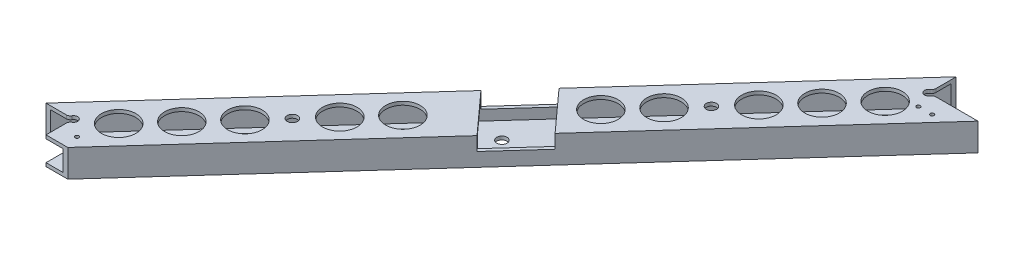
from build123d import *

# Parameters (mm, degrees)
BOSS_EXTRUDE1_DEPTH          = 25.4
CUT_EXTRUDE1_DEPTH           = 12.7
SKETCH3_W                    = 44.450000002
SKETCH3_H                    = 19.05
CUT_EXTRUDE2_DEPTH           = 645.494549375
F_3_8_0_375_DIAMETER_HOLE1_D = 9.525
CUT_EXTRUDE3_DEPTH           = 637.52463446
F_8_32_TAPPED_HOLE1_D        = 3.4544
SKETCH9_R                    = 3.81
CUT_EXTRUDE4_DEPTH           = 637.52463446
FILLET1_R                    = 3.81
F_8_32_TAPPED_HOLE2_D        = 3.4544
SKETCH12_R                   = 15.875000001
CUT_EXTRUDE5_DEPTH           = 637.52463446


with BuildPart() as part:
    # Sketch1 → Boss-Extrude1 (new body)
    with BuildSketch(Plane(origin=(0, 0, 0), x_dir=(1, 0, 0), z_dir=(0, 1, 0))):
        Polygon((386.547411153, 441.325), (432.072013268, 441.325), (12.7, -22.245579509), (12.7, 25.4), (-12.7, 25.4), (386.547411153, 466.725), align=None)
    extrude(amount=BOSS_EXTRUDE1_DEPTH)

    # Sketch2 → Cut-Extrude1 (cut)
    with BuildSketch(Plane(origin=(0, 25.4, 0), x_dir=(1, 0, 0), z_dir=(0, 1, 0))):
        Polygon((212.323705576, 274.139463524), (246.575140768, 236.278192008), (212.323705576, 198.416920491), (178.072270385, 236.278192008), align=None)
    extrude(amount=-CUT_EXTRUDE1_DEPTH, mode=Mode.SUBTRACT)

    # Sketch3 → Cut-Extrude2 (cut, through all)
    with BuildSketch(Plane(origin=(-5.351336248, 0, 5.915325694), x_dir=(-0.7415747649396567, 0, -0.6708702318665609), z_dir=(0.6708702318665609, 0, -0.7415747649396567))):
        with Locations((1.058103403, 12.7)):
            Rectangle(SKETCH3_W, SKETCH3_H)
    extrude(amount=CUT_EXTRUDE2_DEPTH, mode=Mode.SUBTRACT)

    # 3/8 (0.375) Diameter Hole1 (through all)
    with Locations(Plane(origin=(0, 25.4, 0), x_dir=(1, 0, 0), z_dir=(0, 1, 0))):
        with Locations((113.347215967, 126.870346004), (297.173362109, 330.070346004), (205.260289038, 228.470346004)):
            Hole(F_3_8_0_375_DIAMETER_HOLE1_D / 2)

    # Sketch6 → Cut-Extrude3 (cut, through all)
    with BuildSketch(Plane(origin=(0, 25.4, 0), x_dir=(1, 0, 0), z_dir=(0, 1, 0))):
        Polygon((12.7, -22.245579509), (32.824602115, 0), (12.7, 0), align=None)
    extrude(amount=-CUT_EXTRUDE3_DEPTH, mode=Mode.SUBTRACT)

    # #8-32 Tapped Hole1 (through all)
    with Locations(Plane(origin=(0, 25.4, 0), x_dir=(1, 0, 0), z_dir=(0, 1, 0))):
        with Locations((28.575, 12.7)):
            Hole(F_8_32_TAPPED_HOLE1_D / 2)

    # Sketch9 → Cut-Extrude4 (cut, through all)
    with BuildSketch(Plane(origin=(0, 25.4, 0), x_dir=(1, 0, 0), z_dir=(0, 1, 0))):
        with Locations((12.7, 25.4)):
            Circle(SKETCH9_R)
        with Locations((386.547411153, 441.325)):
            Circle(SKETCH9_R)
    extrude(amount=-CUT_EXTRUDE4_DEPTH, mode=Mode.SUBTRACT)

    # Fillet1
    fillet1_edges = [part.edges().sort_by_distance(p)[0] for p in [
        (12.7, 1.5875, -21.59),
        (12.7, 23.8125, -21.59),
        (8.89, 1.5875, -25.4),
        (8.89, 23.8125, -25.4),
        (390.357411153, 23.8125, -441.325),
        (390.357411153, 1.5875, -441.325),
        (386.547411153, 1.5875, -445.135),
        (386.547411153, 23.8125, -445.135),
    ]]
    fillet(fillet1_edges, radius=FILLET1_R)

    # #8-32 Tapped Hole2 (through all)
    with Locations(Plane(origin=(0, 25.4, 0), x_dir=(1, 0, 0), z_dir=(0, 1, 0))):
        with Locations((392.897411153, 425.45), (405.597411153, 425.45)):
            Hole(F_8_32_TAPPED_HOLE2_D / 2)

    # Sketch12 → Cut-Extrude5 (cut, through all)
    with BuildSketch(Plane(origin=(0, 25.4, 0), x_dir=(1, 0, 0), z_dir=(0, 1, 0))):
        with Locations((37.163816951, 42.657806031)):
            Circle(SKETCH12_R)
        with Locations((64.853985771, 73.266304454)):
            Circle(SKETCH12_R)
        with Locations((92.544154592, 103.874802877)):
            Circle(SKETCH12_R)
        with Locations((134.150277343, 149.865889131)):
            Circle(SKETCH12_R)
        with Locations((161.840446163, 180.474387554)):
            Circle(SKETCH12_R)
        with Locations((373.356761126, 414.282885977)):
            Circle(SKETCH12_R)
        with Locations((345.666592305, 383.674387554)):
            Circle(SKETCH12_R)
        with Locations((317.976423485, 353.065889131)):
            Circle(SKETCH12_R)
        with Locations((248.680131914, 276.466304454)):
            Circle(SKETCH12_R)
        with Locations((276.370300734, 307.074802877)):
            Circle(SKETCH12_R)
    extrude(amount=-CUT_EXTRUDE5_DEPTH, mode=Mode.SUBTRACT)


solid = part.part
